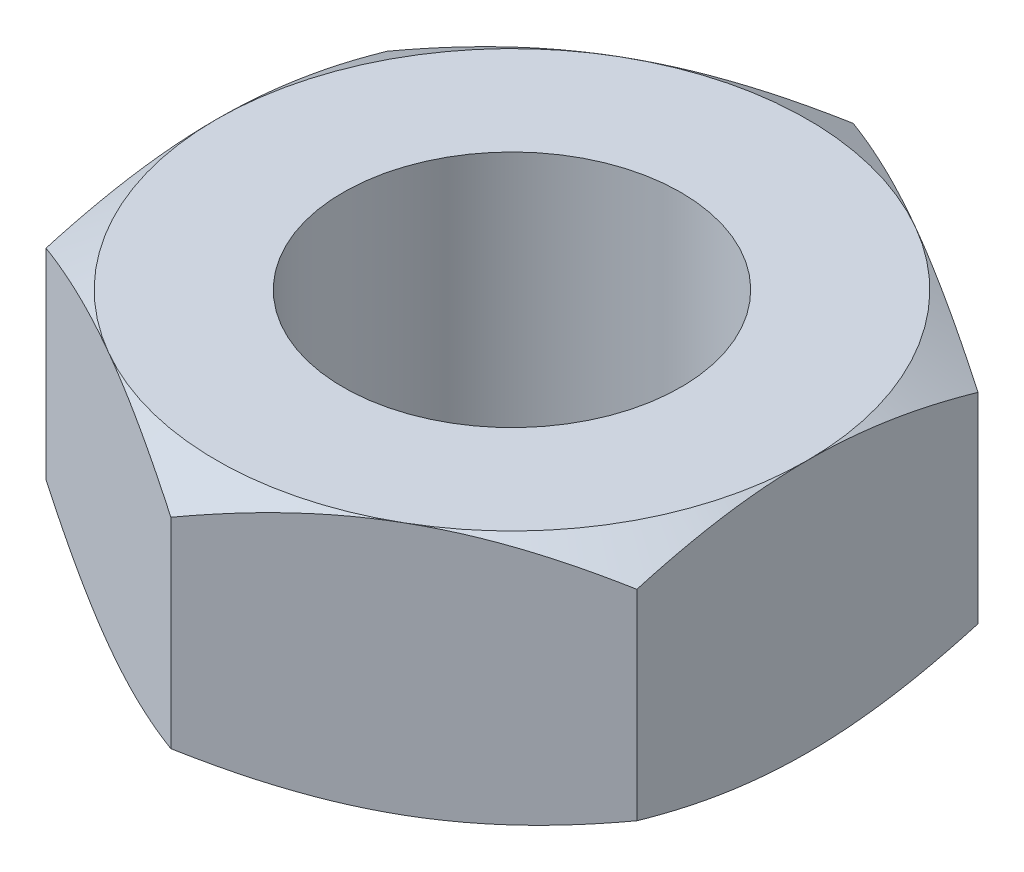
from build123d import *

# Parameters (mm, degrees)
SKETCH1_R               = 3.175
BOSS_EXTRUDE1_DEPTH     = 2.38125
SKETCH5_OUTSIDE_W       = 53.816
SKETCH5_OUTSIDE_H       = 55.536
SKETCH5_OUTSIDE_R       = 5.55625
CUT_EXTRUDE2_DEPTH      = 10.732207992
CUT_EXTRUDE2_DRAFT      = -60
MIRROR1_COPY_1_SKETCH_W = 53.816
MIRROR1_COPY_1_SKETCH_H = 55.536
MIRROR1_COPY_1_SKETCH_R = 5.55625
MIRROR1_COPY_1_DEPTH    = 10.732207992
MIRROR1_COPY_1_DRAFT    = -60


with BuildPart() as part:
    # Sketch1 → Boss-Extrude1 (new, symmetric)
    with BuildSketch(Plane(origin=(0, 0, 0), x_dir=(1, 0, 0), z_dir=(0, 1, 0))):
        Polygon((-5.55625, 3.207902433), (-5.55625, -3.207902433), (0, -6.415804866), (5.55625, -3.207902433), (5.55625, 3.207902433), (0, 6.415804866), align=None)
        Circle(SKETCH1_R, mode=Mode.SUBTRACT)
    extrude(amount=BOSS_EXTRUDE1_DEPTH, both=True)


with BuildPart() as cut_extrude2_tool:
    # Sketch5 outside → Cut-Extrude2 (with draft: the straight prism first)
    with BuildSketch(Plane(origin=(0, 2.38125, 0), x_dir=(1, 0, 0), z_dir=(0, 1, 0))):
        Rectangle(SKETCH5_OUTSIDE_W, SKETCH5_OUTSIDE_H)
        Circle(SKETCH5_OUTSIDE_R, mode=Mode.SUBTRACT)
    extrude(amount=-CUT_EXTRUDE2_DEPTH)
    # Cut-Extrude2: the draft: its side faces are tilted about the plane it starts from
    cut_extrude2_sides = [cut_extrude2_tool.faces().sort_by_distance(p)[0] for p in [
        (0, -2.984853996, 27.768),
        (26.908, -2.984853996, 0),
        (0, -2.984853996, -27.768),
        (-26.908, -2.984853996, 0),
        (-5.55625, -2.984853996, 0),
    ]]
    draft(cut_extrude2_sides, Plane(origin=(0, 2.38125, 0), x_dir=(1, 0, 0), z_dir=(0, 1, 0)), CUT_EXTRUDE2_DRAFT)


with BuildPart() as part_1:
    add(part.part)

    # Cut-Extrude2: cut by cut_extrude2_tool
    add(cut_extrude2_tool.part, mode=Mode.SUBTRACT)


with BuildPart() as mirror1_copy_1_tool:
    # Mirror1 copy 1 sketch → Mirror1 copy 1 (with draft: the straight prism first)
    with BuildSketch(Plane.XZ.offset(2.38125)):
        Rectangle(MIRROR1_COPY_1_SKETCH_W, MIRROR1_COPY_1_SKETCH_H)
        Circle(MIRROR1_COPY_1_SKETCH_R, mode=Mode.SUBTRACT)
    extrude(amount=-MIRROR1_COPY_1_DEPTH)
    # Mirror1 copy 1: the draft: its side faces are tilted about the plane it starts from
    mirror1_copy_1_sides = [mirror1_copy_1_tool.faces().sort_by_distance(p)[0] for p in [
        (0, 2.984853996, 27.768),
        (26.908, 2.984853996, 0),
        (0, 2.984853996, -27.768),
        (-26.908, 2.984853996, 0),
        (-5.55625, 2.984853996, 0),
    ]]
    draft(mirror1_copy_1_sides, Plane.XZ.offset(2.38125), MIRROR1_COPY_1_DRAFT)


with BuildPart() as part_2:
    add(part_1.part)

    # Mirror1 copy 1: cut by mirror1_copy_1_tool
    add(mirror1_copy_1_tool.part, mode=Mode.SUBTRACT)


solid = part_2.part
